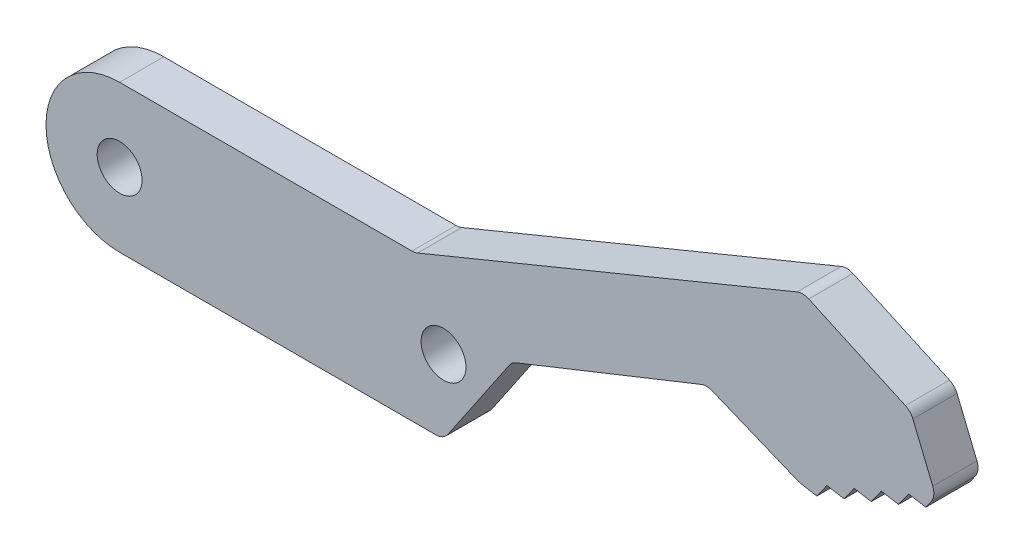
from build123d import *

# Parameters (mm, degrees)
SKETCH1_R           = 1.525
BOSS_EXTRUDE1_DEPTH = 3
FILLET1_R           = 1


with BuildPart() as part:
    # Sketch1 → Boss-Extrude1 (new body)
    # profile 1 of 2: a face of its own
    with BuildSketch(Plane.XY):
        with BuildLine():
            Line((20.05, 5), (0, 5))
            ThreePointArc((0, 5), (-5, 0), (0, -5))
            Line((0, -5), (22, -5))
            Line((22, -5), (26.644435765, 1.851814361))
            ThreePointArc((26.644435765, 1.851814361), (24.805434743, 4.138784351), (22, 5))
            Line((22, 5), (20.05, 5))
        make_face()
        Circle(SKETCH1_R, mode=Mode.SUBTRACT)
        with Locations((22, 0)):
            Circle(SKETCH1_R, mode=Mode.SUBTRACT)
    # profile 2 of 2: a face of its own
    with BuildSketch(Plane.XY):
        with BuildLine():
            Line((46.409029503, 15.837507263), (20.05, 5))
            Line((20.05, 5), (22, 5))
            ThreePointArc((22, 5), (24.805434743, 4.138784351), (26.644435765, 1.851814361))
            Line((26.644435765, 1.851814361), (39.871788822, 7.125781662))
            Line((39.871788822, 7.125781662), (46.188488025, 4.540007042))
            Line((46.188488025, 4.540007042), (47.352932204, 4.337597171))
            Line((47.352932204, 4.337597171), (48.038244482, 5.300533868))
            Line((48.038244482, 5.300533868), (49.20268866, 5.098123997))
            Line((49.20268866, 5.098123997), (49.888000938, 6.061060693))
            Line((49.888000938, 6.061060693), (51.052445116, 5.858650822))
            Line((51.052445116, 5.858650822), (51.737757394, 6.821587519))
            Line((51.737757394, 6.821587519), (52.902201573, 6.619177648))
            Line((52.902201573, 6.619177648), (53.587513851, 7.582114344))
            Line((53.587513851, 7.582114344), (54.751958029, 7.379704473))
            Line((54.751958029, 7.379704473), (55.437270307, 8.34264117))
            Line((55.437270307, 8.34264117), (53.72608495, 12.504593197))
            Line((53.72608495, 12.504593197), (46.409029503, 15.837507263))
        make_face()
    extrude(amount=BOSS_EXTRUDE1_DEPTH)

    # Fillet1
    fillet1_edges = [part.edges().sort_by_distance(p)[0] for p in [
        (22, -5, 1.5),
        (20.05, 5, 1.5),
        (46.409029503, 15.837507263, 1.5),
        (53.72608495, 12.504593197, 1.5),
        (55.437270307, 8.34264117, 1.5),
        (46.188488025, 4.540007042, 1.5),
        (39.871788822, 7.125781662, 1.5),
        (26.644435765, 1.851814361, 1.5),
    ]]
    fillet(fillet1_edges, radius=FILLET1_R)


solid = part.part
